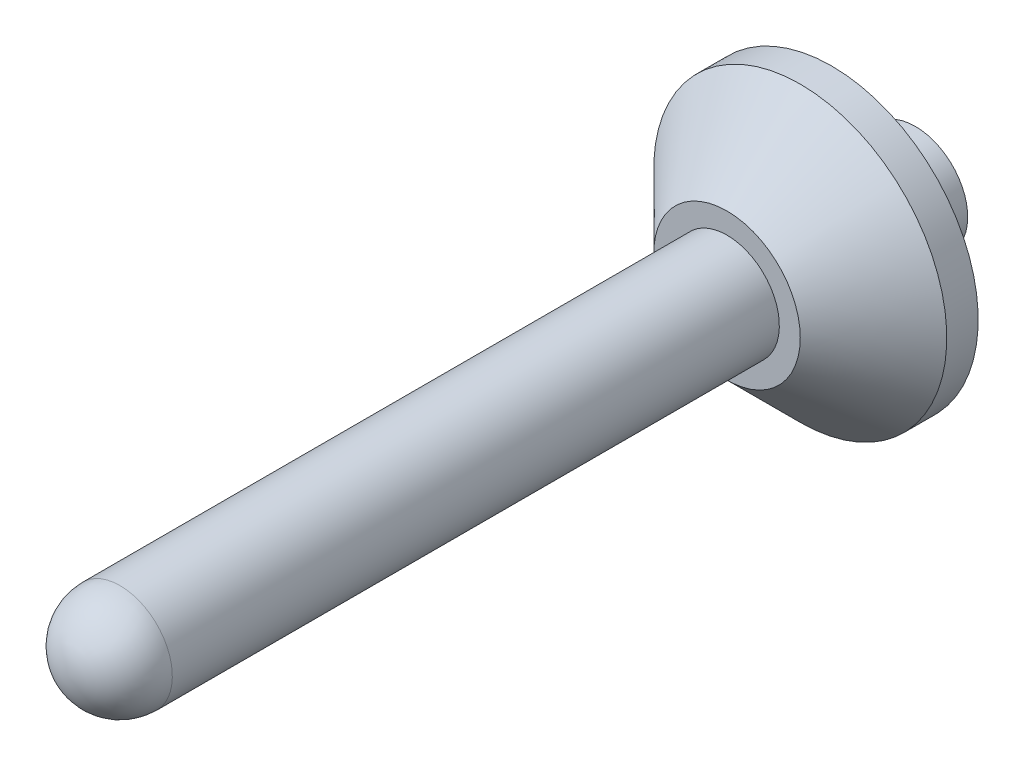
from build123d import *

# Parameters (mm, degrees)
SKETCH_2_R          = 12
SKETCH_2_R_2        = 5
CUT_EXTRUDE_1_DEPTH = 3
SKETCH_3_W          = 5
SKETCH_3_H          = 2


with BuildPart() as part:
    # 草图1 → 旋转1 (revolve)
    with BuildSketch(Plane(origin=(0, 0, 0), x_dir=(0, 0, -1), z_dir=(1, 0, 0))):
        with BuildLine():
            Line((-76, 5), (-20, 5))
            Line((-20, 5), (-11, 14))
            Line((-11, 14), (-8, 14))
            Line((-8, 14), (-8, 5))
            Line((-8, 5), (0, 5))
            Line((0, 5), (0, 0))
            Line((0, 0), (-81, 0))
            ThreePointArc((-81, 0), (-79.535533906, 3.535533906), (-76, 5))
        make_face()
    revolve(axis=Axis((0, 0, 0), (0, 0, 1)))

    # 草图2 → 切除-拉伸1 (cut)
    with BuildSketch(Plane(origin=(0, 0, 8), x_dir=(-1, 0, 0), z_dir=(0, 0, -1))):
        with Locations(Location((0, 0, 0), (0, 0, 90))):
            Circle(SKETCH_2_R)
        with Locations(Location((0, 0, 0), (0, 0, 90))):
            Circle(SKETCH_2_R_2, mode=Mode.SUBTRACT)
    extrude(amount=-CUT_EXTRUDE_1_DEPTH, mode=Mode.SUBTRACT)

    # 草图3 → 切除-旋转1 (revolve, cut)
    with BuildSketch(Plane(origin=(0, 0, 0), x_dir=(1, 0, 0), z_dir=(0, 1, 0)), mode=Mode.PRIVATE) as cut_revolve_1_sk:
        with Locations((7.5, -19)):
            Rectangle(SKETCH_3_W, SKETCH_3_H)
    revolve(cut_revolve_1_sk.sketch.rotate(Axis((0, 0, 20), (0, 0, 1)), 90), axis=Axis((0, 0, 20), (0, 0, 1)), mode=Mode.SUBTRACT)


solid = part.part
